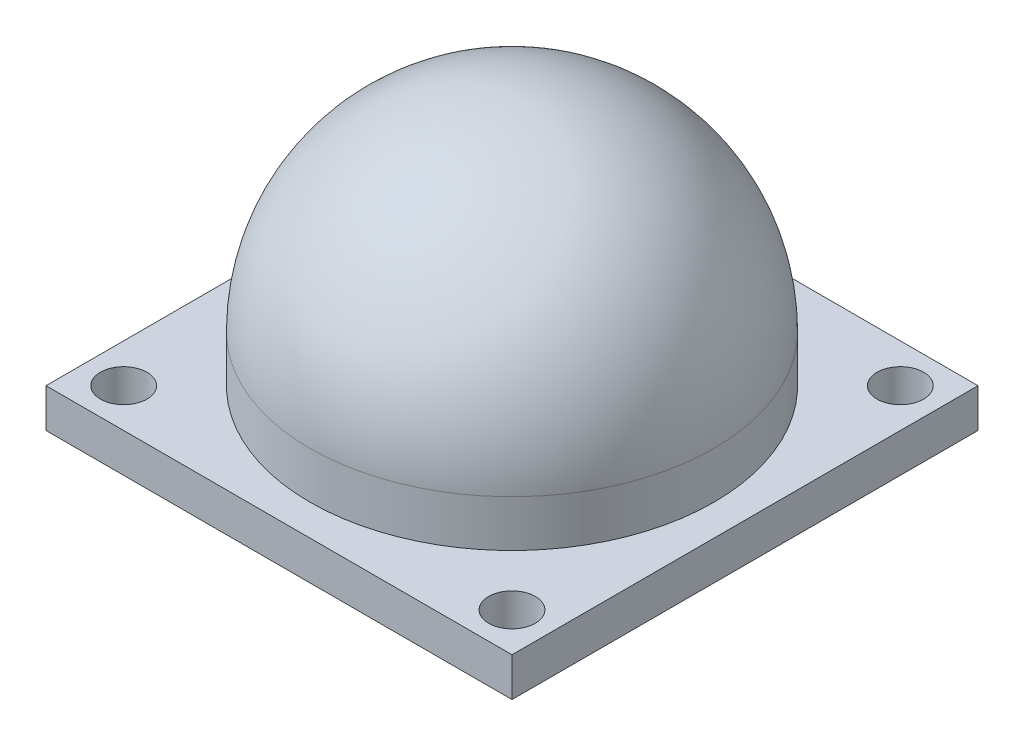
from build123d import *

# Parameters (mm, degrees)
SKETCH_1_W      = 30
SKETCH_1_H      = 30
SKETCH_1_R      = 1.5
EXTRUDE_1_DEPTH = 2.5
SKETCH_2_R      = 13
EXTRUDE_2_DEPTH = 3
REVOLVE_1_ANGLE = 180


with BuildPart() as part:
    # Эскиз1 → Бобышка-Вытянуть1 (new body)
    with BuildSketch(Plane(origin=(0, 0, 0), x_dir=(1, 0, 0), z_dir=(0, 1, 0))):
        Rectangle(SKETCH_1_W, SKETCH_1_H)
        with Locations(Location((-12.5, 12.5, 0), (0, 0, 270))):
            Circle(SKETCH_1_R, mode=Mode.SUBTRACT)
        with Locations(Location((12.5, 12.5, 0), (0, 0, 270))):
            Circle(SKETCH_1_R, mode=Mode.SUBTRACT)
        with Locations(Location((-12.5, -12.5, 0), (0, 0, 270))):
            Circle(SKETCH_1_R, mode=Mode.SUBTRACT)
        with Locations(Location((12.5, -12.5, 0), (0, 0, 270))):
            Circle(SKETCH_1_R, mode=Mode.SUBTRACT)
    extrude(amount=EXTRUDE_1_DEPTH)

    # Эскиз2 → Бобышка-Вытянуть2 (add)
    with BuildSketch(Plane(origin=(0, 2.5, 0), x_dir=(1, 0, 0), z_dir=(0, 1, 0))):
        with Locations(Location((0, 0, 0), (0, 0, 270))):
            Circle(SKETCH_2_R)
    extrude(amount=EXTRUDE_2_DEPTH)

    # Эскиз3 → Повернуть1 (revolve)
    with BuildSketch(Plane(origin=(0, 5.5, 0), x_dir=(1, 0, 0), z_dir=(0, 1, 0))):
        with BuildLine():
            Line((0, 13), (0, -13))
            ThreePointArc((0, -13), (-13, 0), (0, 13))
        make_face()
    revolve(axis=Axis((0, 5.5, -13), (0, 0, -1)), revolution_arc=REVOLVE_1_ANGLE)


solid = part.part
